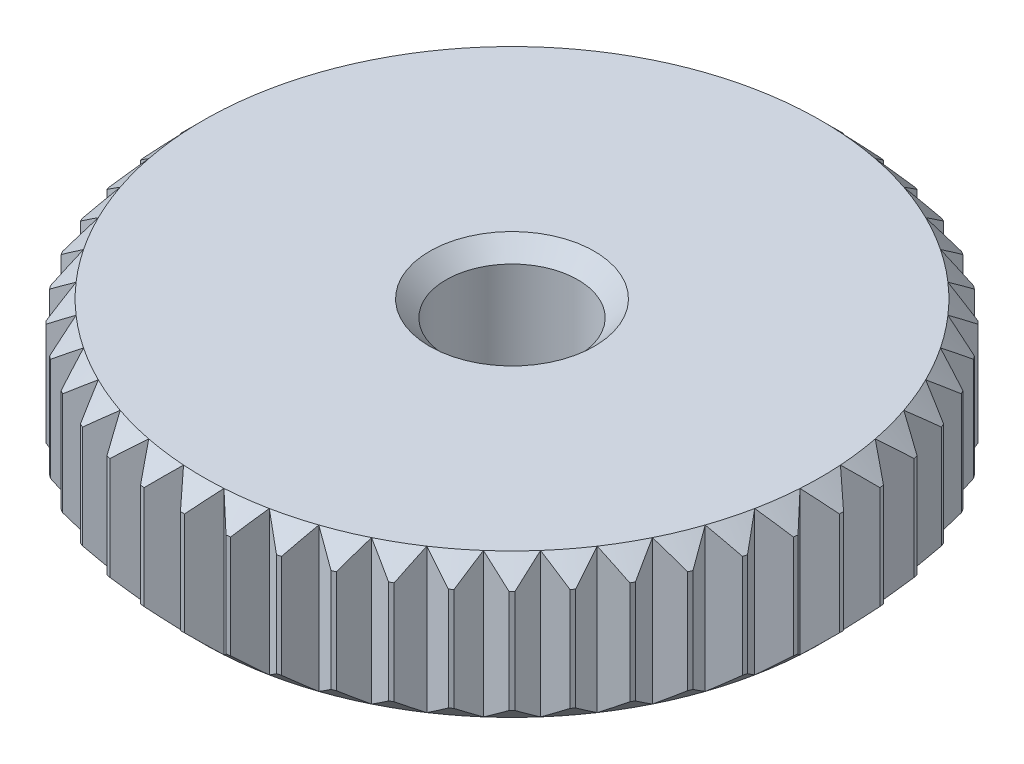
from build123d import *

# Parameters (mm, degrees)
CUT_EXTRUDE1_DEPTH = 13.000000001
CIRPATTERN1_COUNT  = 48


with BuildPart() as part:
    # Sketch6 → Revolve1 (revolve)
    with BuildSketch(Plane(origin=(0, 0, 0), x_dir=(0, 0, -1), z_dir=(1, 0, 0))):
        with BuildLine():
            Line((-1.6, 1.349999999), (-2.000000001, 1.75))
            Line((-2.000000001, 1.75), (-7.500000001, 1.75))
            Line((-7.500000001, 1.75), (-8.000000001, 1.25))
            Line((-8.000000001, 1.25), (-8.000000001, -1.25))
            Line((-8.000000001, -1.25), (-7.500000001, -1.75))
            Line((-7.500000001, -1.75), (-4.500000001, -1.75))
            ThreePointArc((-4.500000001, -1.75), (-4.14644661, -1.896446609), (-4.000000001, -2.25))
            Line((-4.000000001, -2.25), (-2.000000001, -2.25))
            Line((-2.000000001, -2.25), (-1.6, -1.849999999))
            Line((-1.6, -1.849999999), (-1.6, 1.349999999))
        make_face()
    revolve(axis=Axis((0, 6.249415699, 0), (0, -1, 0)))

    # Sketch7 → Cut-Extrude1 (cut, through all)
    with BuildSketch(Plane(origin=(0, 1.75, 0), x_dir=(1, 0, 0), z_dir=(0, 1, 0))):
        with BuildLine():
            Line((0.05, 7.999843749), (0.490523469, 7.483941925))
            Line((0.490523469, 7.483941925), (0.9946169, 7.937930287))
            ThreePointArc((0.9946169, 7.937930287), (0.523225034, 7.982871387), (0.05, 7.999843749))
        make_face()
    cut_extrude1 = extrude(amount=-CUT_EXTRUDE1_DEPTH, mode=Mode.SUBTRACT)

    # CirPattern1: Cut-Extrude1 ×48 about axis
    cirpattern1_axis = Axis((0, 0, 0), (0, 1, 0))
    for i in range(1, CIRPATTERN1_COUNT):
        add(cut_extrude1.rotate(cirpattern1_axis, i * 360 / CIRPATTERN1_COUNT), mode=Mode.SUBTRACT)


solid = part.part
